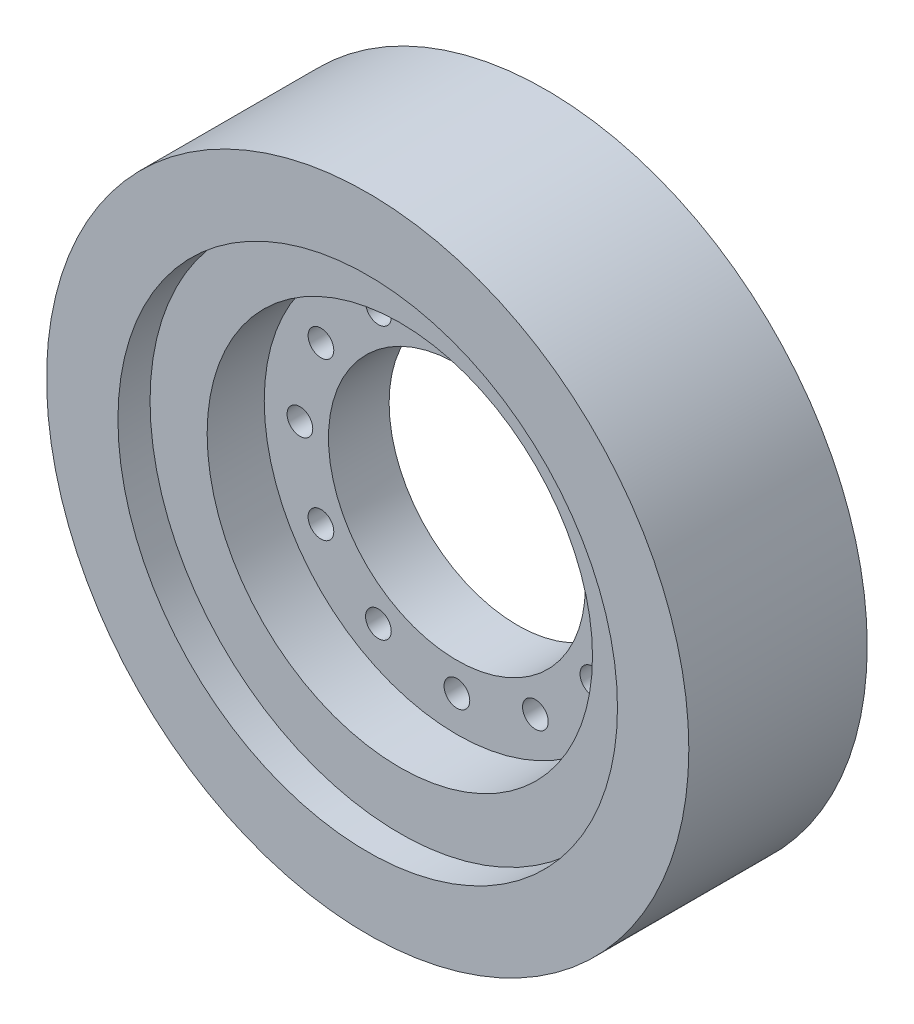
from build123d import *

# Parameters (mm, degrees)
SKETCH_1_R                = 45
EXTRUDE_2_DEPTH           = 25
SKETCH_2_R                = 35
CUT_EXTRUDE_1_DEPTH       = 4.5
SKETCH_3_R                = 27
CUT_EXTRUDE_2_DEPTH       = 8
SKETCH_4_R                = 18
CUT_EXTRUDE_3_DEPTH       = 8.5
SKETCH_10_R               = 42.5
CUT_EXTRUDE_5_DEPTH       = 4
HOLE_WIZARD_2_D           = 3.6
HOLE_WIZARD_2_CBORE_D     = 6
HOLE_WIZARD_2_CBORE_DEPTH = 3.4
PATTERN_CIRCULAR_2_COUNT  = 12
PATTERN_CIRCULAR_3_COUNT  = 8


with BuildPart() as part:
    # 草图1 → 凸台-拉伸2 (new body)
    with BuildSketch(Plane.XY):
        Circle(SKETCH_1_R)
    extrude(amount=EXTRUDE_2_DEPTH)

    # 草图2 → 切除-拉伸1 (cut)
    with BuildSketch(Plane.XY.offset(25)):
        Circle(SKETCH_2_R)
    extrude(amount=-CUT_EXTRUDE_1_DEPTH, mode=Mode.SUBTRACT)

    # 草图3 → 切除-拉伸2 (cut)
    with BuildSketch(Plane.XY.offset(20.5)):
        Circle(SKETCH_3_R)
    extrude(amount=-CUT_EXTRUDE_2_DEPTH, mode=Mode.SUBTRACT)

    # 草图4 → 切除-拉伸3 (cut)
    with BuildSketch(Plane.XY.offset(12.5)):
        Circle(SKETCH_4_R)
    extrude(amount=-CUT_EXTRUDE_3_DEPTH, mode=Mode.SUBTRACT)

    # 草图10 → 切除-拉伸5 (cut)
    with BuildSketch(Plane(origin=(0, 0, 0), x_dir=(-1, 0, 0), z_dir=(0, 0, -1))):
        Circle(SKETCH_10_R)
    extrude(amount=-CUT_EXTRUDE_5_DEPTH, mode=Mode.SUBTRACT)

    # 打孔尺寸(%根据)内六角圆柱头螺钉的类型2 (through all)
    with Locations(Plane(origin=(0, 0, 4), x_dir=(-1, 0, 0), z_dir=(0, 0, -1))):
        with Locations((0, 22)):
            hole_wizard_2 = CounterBoreHole(HOLE_WIZARD_2_D / 2, HOLE_WIZARD_2_CBORE_D / 2, HOLE_WIZARD_2_CBORE_DEPTH)

    # 阵列(圆周)2: 打孔尺寸(%根据)内六角圆柱头螺钉的类型2 ×12 about axis
    pattern_circular_2_axis = Axis((0, 0, 25), (0, 0, -1))
    for i in range(1, PATTERN_CIRCULAR_2_COUNT):
        add(hole_wizard_2.rotate(pattern_circular_2_axis, i * 360 / PATTERN_CIRCULAR_2_COUNT), mode=Mode.SUBTRACT)

    # 草图17 → M3 螺纹孔1 (revolve, cut)
    with BuildSketch(Plane(origin=(0, 37.5, 4), x_dir=(0, 1, 0), z_dir=(1, 0, 0))):
        Polygon((0, 0), (0, 7.251075774), (1.25, 6.5), (1.25, 0), align=None)
    hole_wizard_m3_1 = revolve(axis=Axis((0, 37.5, -2.35), (0, 0, 1)), mode=Mode.SUBTRACT)

    # 阵列(圆周)3: M3 螺纹孔1 ×8 about axis
    pattern_circular_3_axis = Axis((0, 0, 25), (0, 0, -1))
    for i in range(1, PATTERN_CIRCULAR_3_COUNT):
        add(hole_wizard_m3_1.rotate(pattern_circular_3_axis, i * 360 / PATTERN_CIRCULAR_3_COUNT), mode=Mode.SUBTRACT)


solid = part.part
